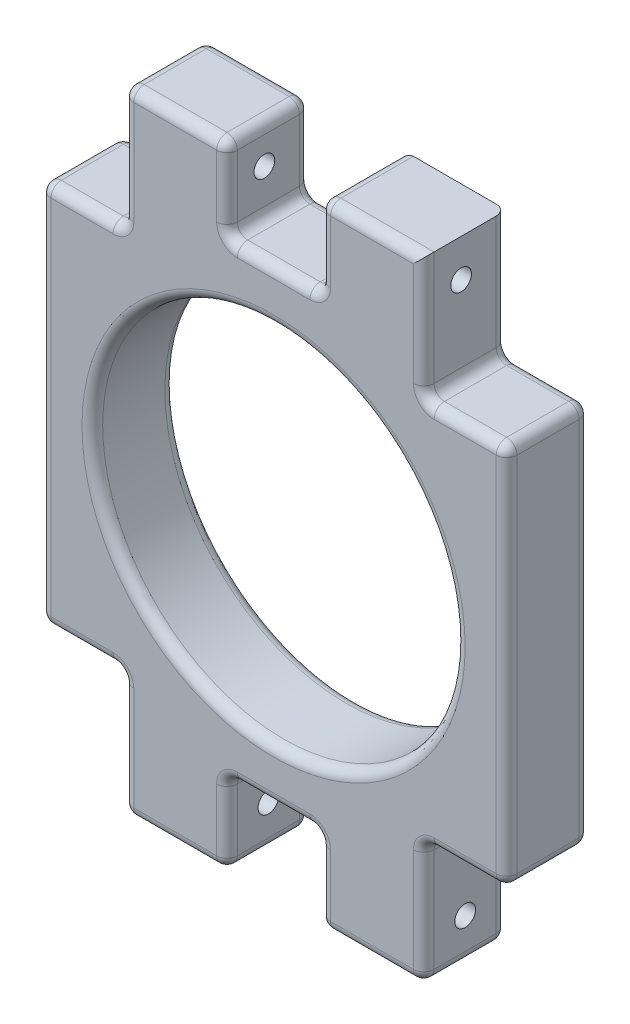
from build123d import *

# Parameters (mm, degrees)
SKETCH2_W               = 10
SKETCH2_H               = 8
SKETCH2_R               = 17.5
BOSS_EXTRUDE1_DEPTH     = 8
FILLET1_R               = 1
CUT_EXTRUDE3_DEPTH      = 42.512046444
CUT_EXTRUDE3_DEPTH_BACK = 42.512046444
SKETCH5_R               = 1
CUT_EXTRUDE4_DEPTH      = 42.512046444
CUT_EXTRUDE4_DEPTH_BACK = 42.512046444
SKETCH6_R               = 1


with BuildPart() as part:
    # Sketch2 → Boss-Extrude1 (new body)
    # profile 1 of 3: a face of its own
    with BuildSketch(Plane.XY):
        with Locations((-9.5, 26.5)):
            Rectangle(SKETCH2_W, SKETCH2_H)
    # profile 2 of 3: a face of its own
    with BuildSketch(Plane.XY):
        Polygon((-4.5, 22.5), (-14.5, 22.5), (-14.5, 18.5), (-22.5, 18.5), (-22.5, -18.5), (-14.5, -18.5), (-14.5, -22.5), (-14.5, -30.5), (-4.5, -30.5), (-4.5, -22.5), (4.5, -22.5), (4.5, -30.5), (14.5, -30.5), (14.5, -22.5), (14.5, -18.5), (22.5, -18.5), (22.5, 18.5), (14.5, 18.5), (14.5, 22.5), (4.5, 22.5), align=None)
        Circle(SKETCH2_R, mode=Mode.SUBTRACT)
    # profile 3 of 3: a face of its own
    with BuildSketch(Plane.XY):
        with Locations((9.5, 26.5)):
            Rectangle(SKETCH2_W, SKETCH2_H)
    extrude(amount=BOSS_EXTRUDE1_DEPTH)

    # Fillet1
    fillet1_edges = [part.edges().sort_by_distance(p)[0] for p in [
        (-18.5, -18.5, 8),
        (-14.5, -24.5, 8),
        (-9.5, -30.5, 8),
        (-4.5, -26.5, 8),
        (0, -22.5, 8),
        (4.5, -26.5, 8),
        (-9.5, -30.5, 0),
        (-14.5, -24.5, 0),
        (-18.5, -18.5, 0),
        (-22.5, 0, 0),
        (-18.5, 18.5, 0),
        (-14.5, 24.5, 0),
        (9.5, -30.5, 8),
        (-9.5, 30.5, 0),
        (-4.5, 26.5, 0),
        (0, 22.5, 0),
        (4.5, 26.5, 0),
        (14.5, 24.5, 0),
        (18.5, 18.5, 0),
        (22.5, 0, 0),
        (18.5, -18.5, 0),
        (14.5, -24.5, 0),
        (14.5, -24.5, 8),
        (9.5, -30.5, 0),
        (4.5, -26.5, 0),
        (0, -22.5, 0),
        (-4.5, -26.5, 0),
        (-17.5, 0, 0),
        (18.5, -18.5, 8),
        (-4.5, -30.5, 4),
        (-14.5, -30.5, 4),
        (-14.5, -18.5, 4),
        (-22.5, -18.5, 4),
        (-22.5, 18.5, 4),
        (-14.5, 18.5, 4),
        (-14.5, 30.5, 4),
        (-4.5, 30.5, 4),
        (-4.5, 22.5, 4),
        (4.5, 22.5, 4),
        (4.5, 30.5, 4),
        (14.5, 18.5, 4),
        (22.5, 18.5, 4),
        (22.5, -18.5, 4),
        (14.5, -18.5, 4),
        (14.5, -30.5, 4),
        (4.5, -30.5, 4),
        (4.5, -22.5, 4),
        (-4.5, -22.5, 4),
        (22.5, 0, 8),
        (18.5, 18.5, 8),
        (14.5, 24.5, 8),
        (9.5, 30.5, 8),
        (4.5, 26.5, 8),
        (-17.5, 0, 8),
        (0, 22.5, 8),
        (-4.5, 26.5, 8),
        (-9.5, 30.5, 8),
        (-14.5, 24.5, 8),
        (-18.5, 18.5, 8),
        (-22.5, 0, 8),
    ]]
    fillet(fillet1_edges, radius=FILLET1_R)

    # Sketch5 → Cut-Extrude3 (cut, two sides: drawn at the far end of the back side and taken through both)
    with BuildSketch(Plane(origin=(-4.5, 0, 0), x_dir=(0, 0, -1), z_dir=(1, 0, 0)).offset(-CUT_EXTRUDE3_DEPTH_BACK)):
        with Locations(Location((-4.389587231, 26.860578682, 0), (0, 0, 90))):
            Circle(SKETCH5_R)
    extrude(amount=CUT_EXTRUDE3_DEPTH + CUT_EXTRUDE3_DEPTH_BACK, mode=Mode.SUBTRACT)

    # Sketch6 → Cut-Extrude4 (cut, two sides: drawn at the far end of the back side and taken through both)
    with BuildSketch(Plane(origin=(-4.5, 0, 0), x_dir=(0, 0, -1), z_dir=(1, 0, 0)).offset(-CUT_EXTRUDE4_DEPTH_BACK)):
        with Locations(Location((-4, -26.5, 0), (0, 0, 270))):
            Circle(SKETCH6_R)
    extrude(amount=CUT_EXTRUDE4_DEPTH + CUT_EXTRUDE4_DEPTH_BACK, mode=Mode.SUBTRACT)


solid = part.part
